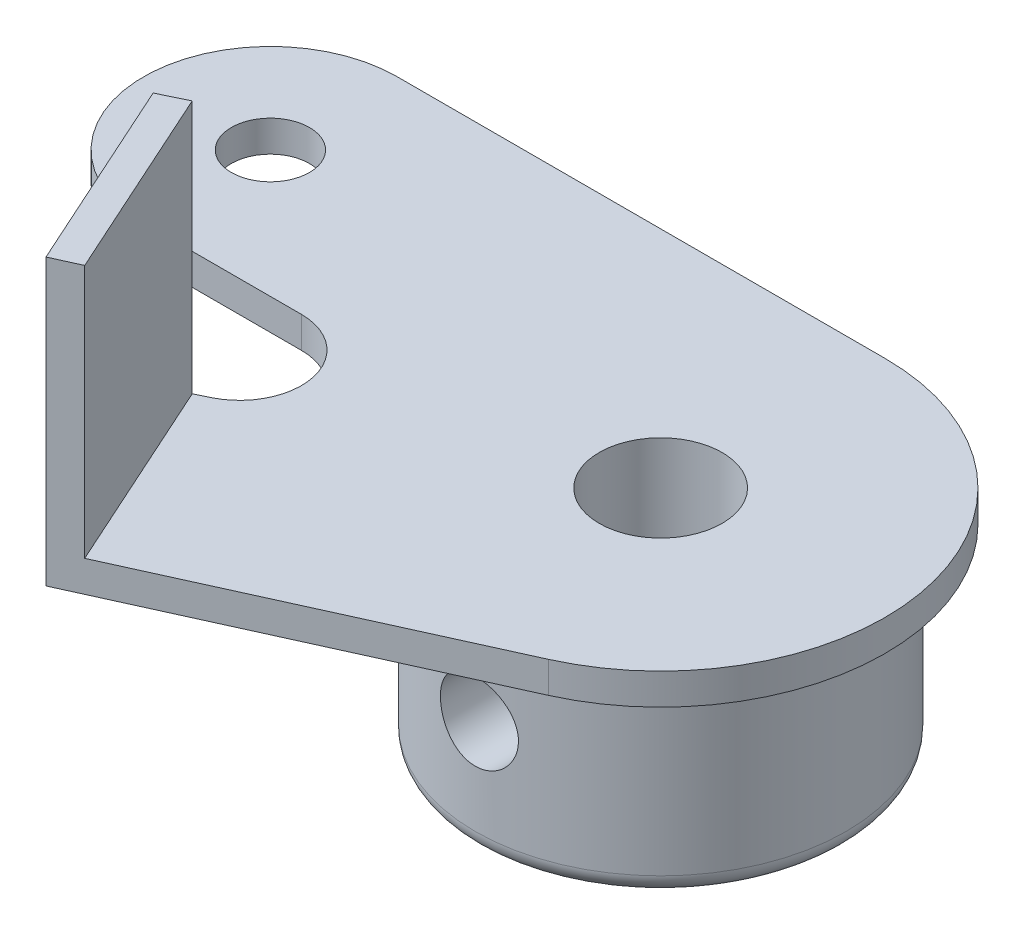
from build123d import *

# Parameters (mm, degrees)
ESQUISSE1_R             = 3.15
ESQUISSE1_R_2           = 2
BOSS_EXTRU_1_DEPTH      = 1.6
BOSS_EXTRU_2_START      = -11.5
ESQUISSE2_R             = 9.5
ESQUISSE2_R_2           = 3.15
BOSS_EXTRU_2_DEPTH      = 11.5
CONG_1_R                = 1
BOSS_EXTRU_3_DEPTH      = 13
ESQUISSE4_R             = 2
ENL_V_MAT_EXTRU_1_DEPTH = 40.340310116


with BuildPart() as part:
    # Esquisse1 → Boss.-Extru.1 (new body)
    with BuildSketch(Plane(origin=(0, 0, 0), x_dir=(1, 0, 0), z_dir=(0, 1, 0))):
        with BuildLine():
            Line((0, 11.5), (-25, 11.5))
            ThreePointArc((-25, 11.5), (-31.5, 5), (-25, -1.5))
            Line((-25, -1.5), (-16.90921754, -1.5))
            ThreePointArc((-16.90921754, -1.5), (-13.826301978, -3.956560509), (-15.532463951, -7.510159982))
            Line((-15.532463951, -7.510159982), (-17.532463951, -8.477187494))
            Line((-17.532463951, -8.477187494), (-13, -18.5))
            Line((-13, -18.5), (4.73848504, -10.478394893))
            ThreePointArc((4.73848504, -10.478394893), (11.241697854, 2.423680954), (0, 11.5))
        make_face()
        with Locations(Location((0, 0, 0), (0, 0, 270))):
            Circle(ESQUISSE1_R, mode=Mode.SUBTRACT)
        with Locations(Location((-25, 5, 0), (0, 0, 270))):
            Circle(ESQUISSE1_R_2, mode=Mode.SUBTRACT)
    extrude(amount=BOSS_EXTRU_1_DEPTH)

    # Esquisse2 → Boss.-Extru.2 (add)
    with BuildSketch(Plane(origin=(0, 1.6, 0), x_dir=(1, 0, 0), z_dir=(0, 1, 0)).offset(BOSS_EXTRU_2_START)):
        with Locations(Location((0, 0, 0), (0, 0, 270))):
            Circle(ESQUISSE2_R)
        with Locations(Location((0, 0, 0), (0, 0, 270))):
            Circle(ESQUISSE2_R_2, mode=Mode.SUBTRACT)
    extrude(amount=BOSS_EXTRU_2_DEPTH)

    # Congé1
    cong_1_edges = [part.edges().sort_by_distance(p)[0] for p in [
        (0, -9.9, -9.5),
    ]]
    fillet(cong_1_edges, radius=CONG_1_R)

    # Esquisse3 → Boss.-Extru.3 (add)
    with BuildSketch(Plane(origin=(0, 1.6, 0), x_dir=(1, 0, 0), z_dir=(0, 1, 0))):
        Polygon((-17.532463951, -8.477187494), (-13, -18.5), (-11.633703391, -17.88214048), (-16.182035998, -7.824237002), align=None)
    extrude(amount=BOSS_EXTRU_3_DEPTH)

    # Esquisse4 → Enlèv. mat.-Extru.1 (cut, through all)
    with BuildSketch(Plane.XY):
        with Locations(Location((0, -4, 0), (0, 0, 269.999999976))):
            Circle(ESQUISSE4_R)
    extrude(amount=ENL_V_MAT_EXTRU_1_DEPTH, mode=Mode.SUBTRACT)


solid = part.part
